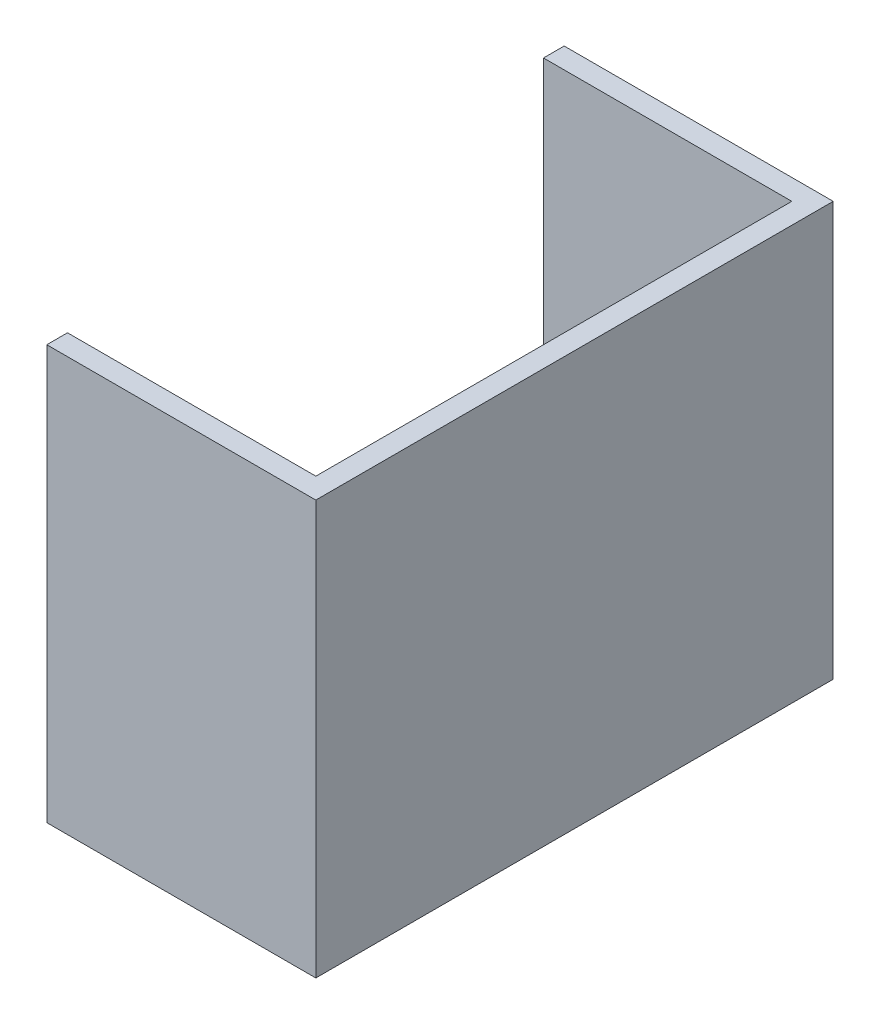
from build123d import *

# Parameters (mm, degrees)
SKETCH_15_W          = 13
SKETCH_15_H          = 25
EXTRUDE_4_DEPTH      = 20
CUT_EXTRUDE_START    = 1
SKETCH_16_W          = 12
SKETCH_16_H          = 23
CUT_EXTRUDE_47_DEPTH = 24.6018292
CUT_EXTRUDE_48_DEPTH = 25.6018292


with BuildPart() as part:
    # 스케치15 → 보스-돌출4 (new body)
    with BuildSketch(Plane(origin=(0, 0, 0), x_dir=(1, 0, 0), z_dir=(0, 1, 0))):
        with Locations((0.5, 0)):
            Rectangle(SKETCH_15_W, SKETCH_15_H)
    extrude(amount=EXTRUDE_4_DEPTH)

    # 스케치16 → 컷-돌출47 (cut, through all)
    with BuildSketch(Plane(origin=(0, 0, 0), x_dir=(1, 0, 0), z_dir=(0, 1, 0)).offset(CUT_EXTRUDE_START)):
        Rectangle(SKETCH_16_W, SKETCH_16_H)
    extrude(amount=CUT_EXTRUDE_47_DEPTH, mode=Mode.SUBTRACT)

    # 스케치17 → 컷-돌출48 (cut, through all)
    with BuildSketch(Plane(origin=(0, 0, 0), x_dir=(1, 0, 0), z_dir=(0, 1, 0))):
        with BuildLine():
            Line((-6, 3.5), (6, 3.5))
            Line((6, 3.5), (6, -5.5))
            ThreePointArc((6, -5.5), (0, -11.5), (-6, -5.5))
            Line((-6, -5.5), (-6, 3.5))
        make_face()
    extrude(amount=CUT_EXTRUDE_48_DEPTH, mode=Mode.SUBTRACT)


solid = part.part
